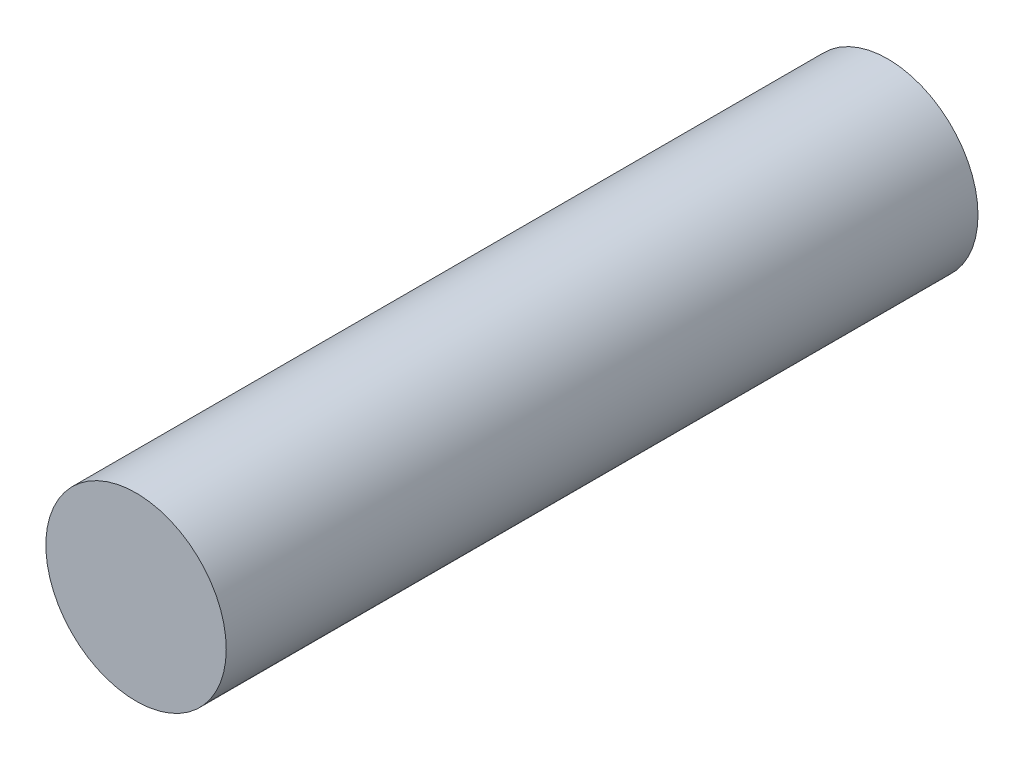
from build123d import *

# Parameters (mm, degrees)
SKETCH1_R           = 1.8
BOSS_EXTRUDE1_DEPTH = 15


with BuildPart() as part:
    # Sketch1 → Boss-Extrude1 (new body)
    with BuildSketch(Plane.XY):
        Circle(SKETCH1_R)
    extrude(amount=BOSS_EXTRUDE1_DEPTH)


solid = part.part
